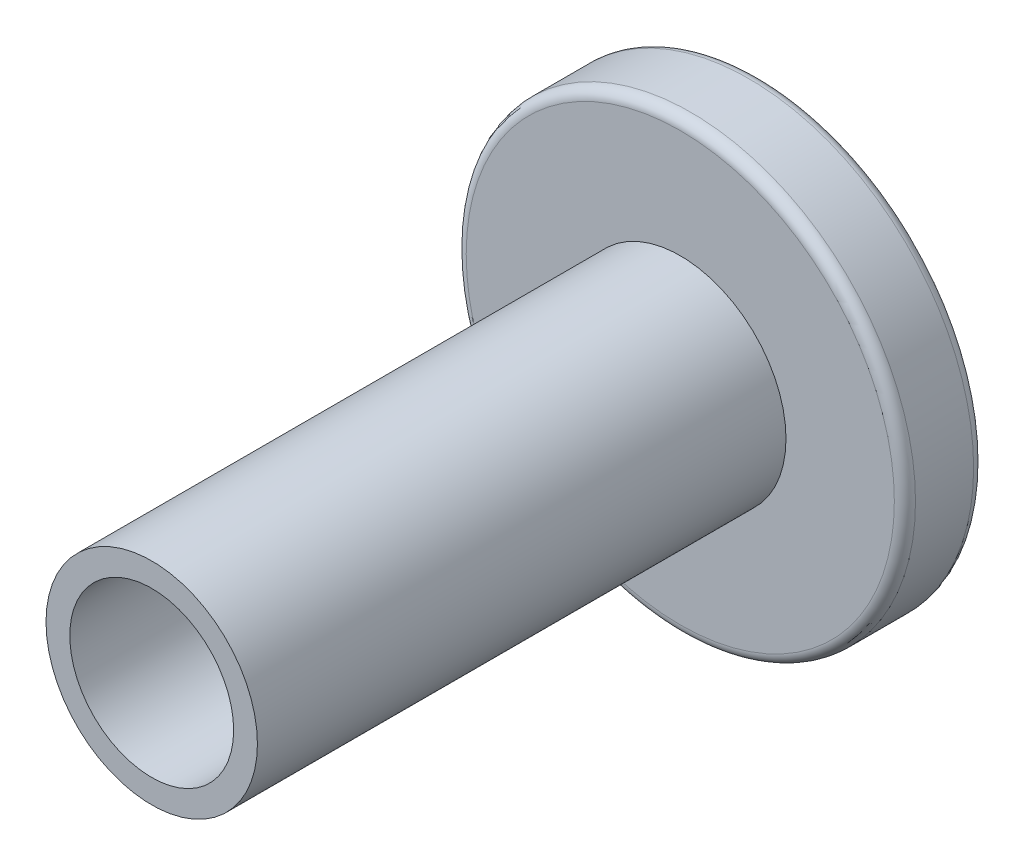
from build123d import *

# Parameters (mm, degrees)
SKETCH_1_R          = 4.25
EXTRUDE_1_DEPTH     = 1.5
SKETCH_2_R          = 2
SKETCH_2_R_2        = 1.55
EXTRUDE_2_DEPTH     = 10
FILLET_1_R          = 0.2
CUT_EXTRUDE_1_DEPTH = 1.5


with BuildPart() as part:
    # 草图1 → 凸台-拉伸1 (new body)
    with BuildSketch(Plane.XY):
        Circle(SKETCH_1_R)
    extrude(amount=EXTRUDE_1_DEPTH)

    # 草图2 → 凸台-拉伸2 (add)
    with BuildSketch(Plane.XY.offset(1.5)):
        Circle(SKETCH_2_R)
        Circle(SKETCH_2_R_2, mode=Mode.SUBTRACT)
    extrude(amount=EXTRUDE_2_DEPTH)

    # 圆角1
    fillet_1_edges = [part.edges().sort_by_distance(p)[0] for p in [
        (-4.25, 0, 0),
        (-4.25, 0, 1.5),
    ]]
    fillet(fillet_1_edges, radius=FILLET_1_R)

    # 草图3 → 切除-拉伸1 (cut)
    with BuildSketch(Plane(origin=(0, 0, 0), x_dir=(-1, 0, 0), z_dir=(0, 0, -1))):
        Polygon((1.443375673, 0), (0.721687836, 1.25), (-0.721687836, 1.25), (-1.443375673, 0), (-0.721687836, -1.25), (0.721687836, -1.25), align=None)
    extrude(amount=-CUT_EXTRUDE_1_DEPTH, mode=Mode.SUBTRACT)


solid = part.part
